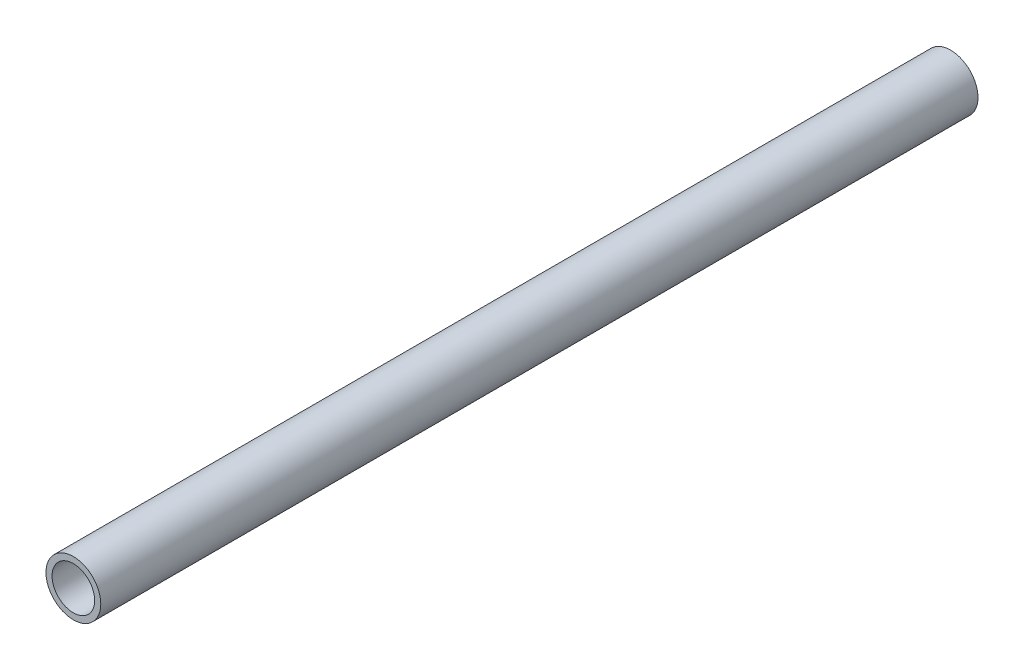
from build123d import *

# Parameters (mm, degrees)
SKETCH1_R           = 28.575
SKETCH1_R_2         = 22.225
BOSS_EXTRUDE1_DEPTH = 914.4
SKETCH2_R           = 4.7625
CUT_EXTRUDE1_DEPTH  = 916.292533155


with BuildPart() as part:
    # Sketch1 → Boss-Extrude1 (new body)
    with BuildSketch(Plane.XY):
        Circle(SKETCH1_R)
        Circle(SKETCH1_R_2, mode=Mode.SUBTRACT)
    extrude(amount=BOSS_EXTRUDE1_DEPTH)

    # Sketch2 → Cut-Extrude1 (cut, through all)
    with BuildSketch(Plane(origin=(0, 0, 0), x_dir=(1, 0, 0), z_dir=(0, 1, 0))):
        with Locations(Location((-3.175, -38.1, 0), (0, 0, 270))):
            Circle(SKETCH2_R)
        with Locations(Location((-0.006183063, -88.801070987, 0), (0, 0, 270))):
            Circle(SKETCH2_R)
        with Locations(Location((0, -876.3, 0), (0, 0, 270))):
            Circle(SKETCH2_R)
        with Locations(Location((0, -825.5, 0), (0, 0, 270))):
            Circle(SKETCH2_R)
    extrude(amount=-CUT_EXTRUDE1_DEPTH, mode=Mode.SUBTRACT)


solid = part.part
